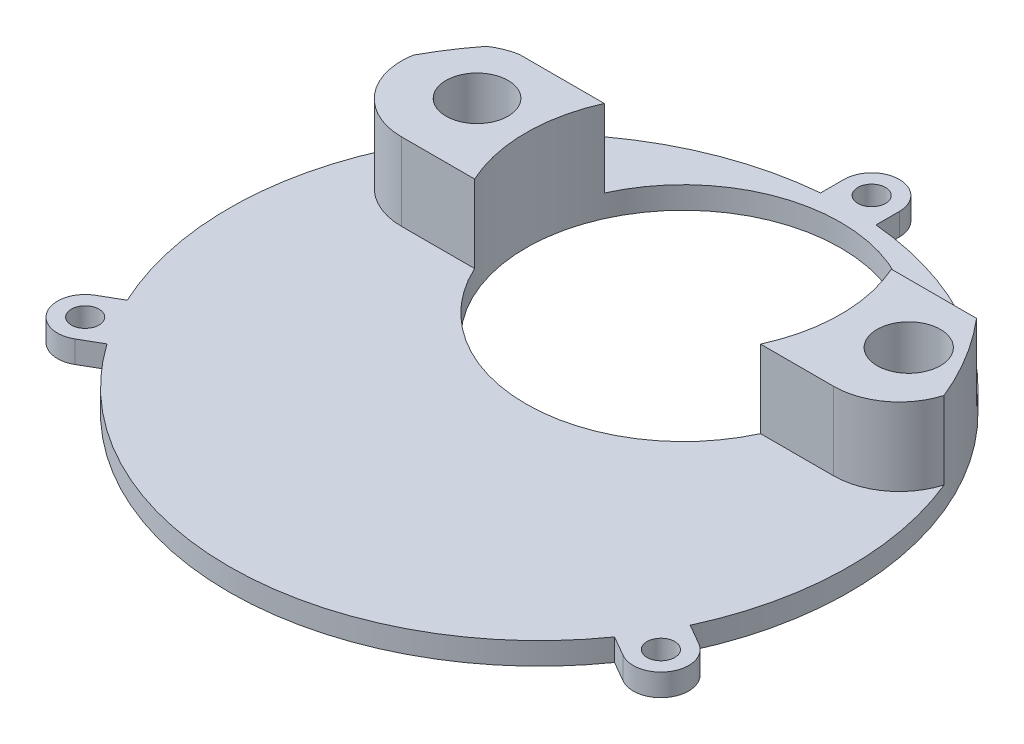
from build123d import *

# Parameters (mm, degrees)
BOSS_EXTRUDE3_DEPTH        = 2
BOSS_EXTRUDE4_START        = 7
BOSS_EXTRUDE4_DEPTH        = 7
F_2_5_2_5_DIAMETER_HOLE2_D = 2.5
M25_CLEARANCE_HOLE2_D      = 28.4
SKETCH27_R                 = 2.8
SKETCH27_R_2               = 2.85
CUT_EXTRUDE7_DEPTH         = 5.5


with BuildPart() as part:
    # Sketch14 → Boss-Extrude3 (new body)
    with BuildSketch(Plane(origin=(0, 2, 0), x_dir=(1, 0, 0), z_dir=(0, 1, 0))):
        with BuildLine():
            Line((-25.401863282, -11.779021258), (-27.230762114, -12.834936491))
            ThreePointArc((-27.230762114, -12.834936491), (-28.145825623, -16.25), (-24.730762114, -17.165063509))
            Line((-24.730762114, -17.165063509), (-22.901863282, -16.109148277))
            ThreePointArc((-22.901863282, -16.109148277), (0, -28), (22.901863282, -16.109148277))
            Line((22.901863282, -16.109148277), (24.730762114, -17.165063509))
            ThreePointArc((24.730762114, -17.165063509), (28.145825623, -16.25), (27.230762114, -12.834936491))
            Line((27.230762114, -12.834936491), (25.401863282, -11.779021258))
            ThreePointArc((25.401863282, -11.779021258), (24.248711306, 14), (2.5, 27.888169535))
            Line((2.5, 27.888169535), (2.5, 30))
            ThreePointArc((2.5, 30), (0, 32.5), (-2.5, 30))
            Line((-2.5, 30), (-2.5, 27.888169535))
            ThreePointArc((-2.5, 27.888169535), (-24.248711306, 14), (-25.401863282, -11.779021258))
        make_face()
    extrude(amount=-BOSS_EXTRUDE3_DEPTH)

    # Sketch15 → Boss-Extrude4 (add)
    with BuildSketch(Plane(origin=(0, 2, 0), x_dir=(-1, 0, 0), z_dir=(0, 1, 0)).offset(BOSS_EXTRUDE4_START)):
        with BuildLine():
            Line((-20.2, -6.36507512), (18.8, -6.36507512))
            ThreePointArc((18.8, -6.36507512), (23.327173423, -8.462287904), (24.654830029, -13.271750307))
            ThreePointArc((24.654830029, -13.271750307), (23.430757061, -15.329697439), (22.035331707, -17.275536361))
            ThreePointArc((22.035331707, -17.275536361), (21.029921495, -17.800071223), (19.943097949, -18.123801199))
            Line((19.943097949, -18.123801199), (-21.343097949, -18.123801199))
            ThreePointArc((-21.343097949, -18.123801199), (-23.915273063, -14.562270232), (-25.898699677, -10.64224389))
            ThreePointArc((-25.898699677, -10.64224389), (-23.762630724, -7.553317405), (-20.2, -6.36507512))
        make_face()
    extrude(amount=-BOSS_EXTRUDE4_DEPTH)

    # Ø2.5 (2.5) Diameter Hole2 (through all)
    with Locations(Plane(origin=(0, 2, 0), x_dir=(1, 0, 0), z_dir=(0, 1, 0))):
        with Locations((-25.980762114, -15), (25.980762114, -15), (0, 30)):
            Hole(F_2_5_2_5_DIAMETER_HOLE2_D / 2)

    # M25 Clearance Hole2 (through all)
    with Locations(Plane(origin=(0, 0, 0), x_dir=(-1, 0, 0), z_dir=(0, -1, 0))):
        with Locations((-0.7, 12.3)):
            Hole(M25_CLEARANCE_HOLE2_D / 2)

    # Sketch27 → Cut-Extrude7 (cut)
    with BuildSketch(Plane(origin=(0, 9, 0), x_dir=(1, 0, 0), z_dir=(0, 1, 0))):
        with Locations(Location((-18.398233243, 12.782862889, 0), (0, 0, 270))):
            Circle(SKETCH27_R)
        with Locations(Location((20.562204281, 12.782862889, 0), (0, 0, 270))):
            Circle(SKETCH27_R_2)
    extrude(amount=-CUT_EXTRUDE7_DEPTH, mode=Mode.SUBTRACT)


solid = part.part
